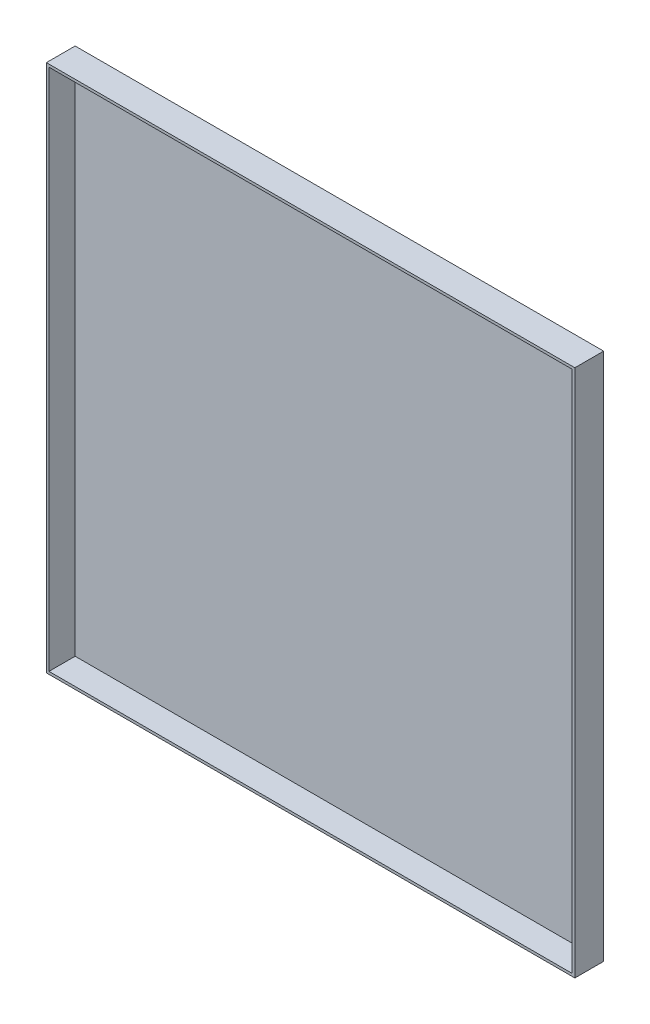
from build123d import *

# Parameters (mm, degrees)
SKETCH_2_W      = 202
SKETCH_2_H      = 202
EXTRUDE_1_DEPTH = 11
SKETCH_1_W      = 200
SKETCH_1_H      = 200
EXTRUDE_2_DEPTH = 10


with BuildPart() as part:
    # 草图2 → 凸台-拉伸1 (new body)
    with BuildSketch(Plane.XY):
        with Locations((86.004694039, 88.571428571)):
            Rectangle(SKETCH_2_W, SKETCH_2_H)
    extrude(amount=-EXTRUDE_1_DEPTH)


with BuildPart() as body_2:
    # 草图1 → 凸台-拉伸2 (new body)
    with BuildSketch(Plane.XY):
        with Locations((86.004694039, 88.571428571)):
            Rectangle(SKETCH_1_W, SKETCH_1_H)
    extrude(amount=-EXTRUDE_2_DEPTH)


with BuildPart() as part_1:
    add(part.part)

    # Combine 1: cut body 2
    add(body_2.part, mode=Mode.SUBTRACT)


solid = part_1.part
